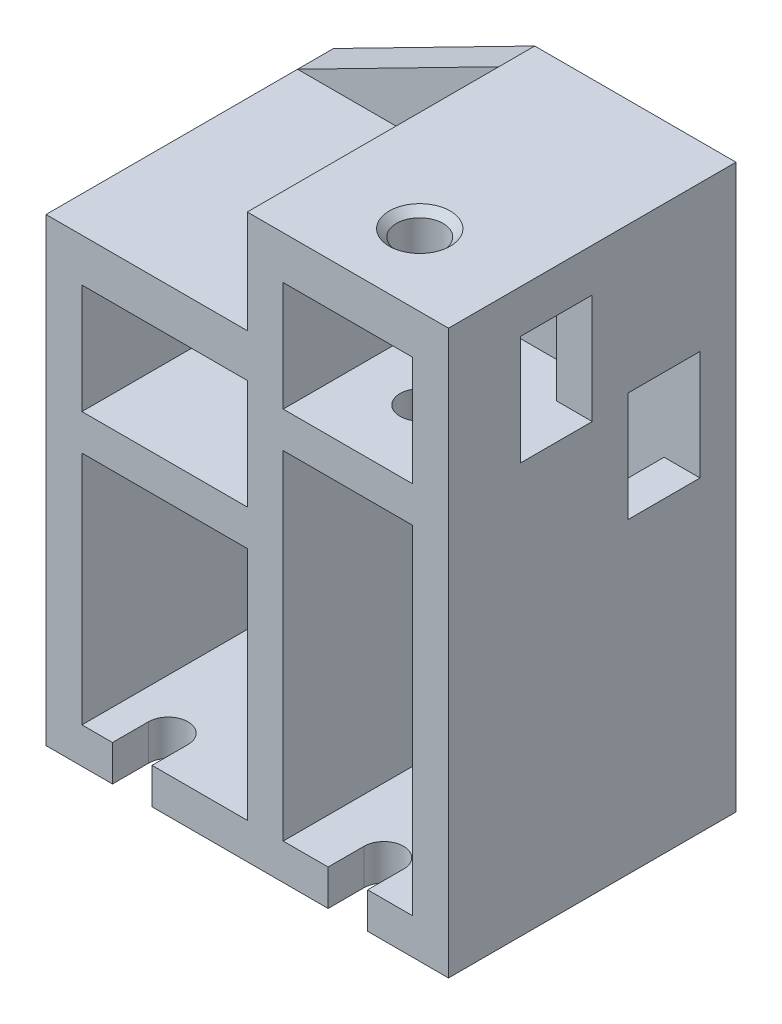
from build123d import *

# Parameters (mm, degrees)
SKETCH1_W           = 23
SKETCH1_H           = 32.75
SKETCH1_W_2         = 18
SKETCH1_H_2         = 15.25
SKETCH1_H_3         = 47.05
BOSS_EXTRUDE1_DEPTH = 40
CUT_EXTRUDE1_REACH  = 106.244
SKETCH2_R           = 2.75
CUT_EXTRUDE2_REACH  = 106.244
SKETCH3_W           = 10
SKETCH3_H           = 15.25
SKETCH4_W           = 10
SKETCH4_H           = 15.25
CUT_EXTRUDE3_DEPTH  = 102.645904984
CUT_EXTRUDE4_REACH  = 106.244
SKETCH6_R           = 3.25
CHAMFER1_SIZE       = 1
CUT_EXTRUDE5_REACH  = 106.244
SKETCH7_R           = 3.3
SKETCH9_R           = 2.75
CUT_EXTRUDE6_DEPTH  = 101.542975886
SKETCH10_W          = 18
SKETCH10_H          = 25
SKETCH10_W_2        = 23
SKETCH10_H_2        = 10.7
BOSS_EXTRUDE2_DEPTH = 5


with BuildPart() as part:
    # Sketch1 → Boss-Extrude1 (new body)
    with BuildSketch(Plane.XY):
        Polygon((0, 0), (0, 64), (28, 64), (28, 78.3), (56, 78.3), (56, 0), align=None)
        with Locations((16.5, 21.375)):
            Rectangle(SKETCH1_W, SKETCH1_H, mode=Mode.SUBTRACT)
        with Locations((42, 64.675)):
            Rectangle(SKETCH1_W_2, SKETCH1_H_2, mode=Mode.SUBTRACT)
        with Locations((16.5, 50.375)):
            Rectangle(SKETCH1_W, SKETCH1_H_2, mode=Mode.SUBTRACT)
        with Locations((42, 28.525)):
            Rectangle(SKETCH1_W_2, SKETCH1_H_3, mode=Mode.SUBTRACT)
    extrude(amount=BOSS_EXTRUDE1_DEPTH)

    # Cut-Extrude1: up to this face of the body (flat: up to its plane)
    cut_extrude1_end = Plane(part.part.faces().sort_by_distance((16.5, 37.75, 20))[0])
    # Sketch2 → Cut-Extrude1 (cut, up to the picked face)
    with BuildSketch(Plane(origin=(0, 78.3, 0), x_dir=(1, 0, 0), z_dir=(0, 1, 0)), mode=Mode.PRIVATE) as cut_extrude1_sk1:
        with Locations(Location((19, -15, 0), (0, 0, 270))):
            Circle(SKETCH2_R)
    cut_extrude1_tool1 = split(extrude(cut_extrude1_sk1.sketch, amount=-CUT_EXTRUDE1_REACH, mode=Mode.PRIVATE), bisect_by=cut_extrude1_end, keep=Keep.BOTH, mode=Mode.PRIVATE)
    # Sketch2 → Cut-Extrude1 (cut, up to the picked face)
    with BuildSketch(Plane(origin=(0, 78.3, 0), x_dir=(1, 0, 0), z_dir=(0, 1, 0)), mode=Mode.PRIVATE) as cut_extrude1_sk2:
        with Locations(Location((42, -30, 0), (0, 0, 270))):
            Circle(SKETCH2_R)
    cut_extrude1_tool2 = split(extrude(cut_extrude1_sk2.sketch, amount=-CUT_EXTRUDE1_REACH, mode=Mode.PRIVATE), bisect_by=cut_extrude1_end, keep=Keep.BOTH, mode=Mode.PRIVATE)
    add(cut_extrude1_tool1.solids().sort_by(Axis((19, 78.3, 15), (0, -1, 0)))[0], mode=Mode.SUBTRACT)
    add(cut_extrude1_tool2.solids().sort_by(Axis((42, 78.3, 30), (0, -1, 0)))[0], mode=Mode.SUBTRACT)

    # Sketch3 → Cut-Extrude2 (cut, up to next)
    with BuildSketch(Plane(origin=(56, 0, 0), x_dir=(0, 0, -1), z_dir=(1, 0, 0)), mode=Mode.PRIVATE) as cut_extrude2_sk1:
        with Locations((-25, 64.675)):
            Rectangle(SKETCH3_W, SKETCH3_H)
    cut_extrude2_tool1 = extrude(cut_extrude2_sk1.sketch, amount=-CUT_EXTRUDE2_REACH, mode=Mode.PRIVATE) & part.part
    add(cut_extrude2_tool1.solids().sort_by_distance((56, 64.675, 25))[0], mode=Mode.SUBTRACT)

    # Sketch4 → Cut-Extrude3 (cut, through all)
    with BuildSketch(Plane(origin=(5, 0, 0), x_dir=(0, 0, -1), z_dir=(1, 0, 0))):
        with Locations((-10, 50.375)):
            Rectangle(SKETCH4_W, SKETCH4_H)
    extrude(amount=CUT_EXTRUDE3_DEPTH, mode=Mode.SUBTRACT)

    # Sketch6 → Cut-Extrude4 (cut, up to next)
    with BuildSketch(Plane(origin=(0, 78.3, 0), x_dir=(1, 0, 0), z_dir=(0, 1, 0)), mode=Mode.PRIVATE) as cut_extrude4_sk1:
        with Locations(Location((19, -15, 0), (0, 0, 270))):
            Circle(SKETCH6_R)
    cut_extrude4_tool1 = extrude(cut_extrude4_sk1.sketch, amount=-CUT_EXTRUDE4_REACH, mode=Mode.PRIVATE) & part.part
    # Sketch6 → Cut-Extrude4 (cut, up to next)
    with BuildSketch(Plane(origin=(0, 78.3, 0), x_dir=(1, 0, 0), z_dir=(0, 1, 0)), mode=Mode.PRIVATE) as cut_extrude4_sk2:
        with Locations(Location((42, -30, 0), (0, 0, 270))):
            Circle(SKETCH6_R)
    cut_extrude4_tool2 = extrude(cut_extrude4_sk2.sketch, amount=-CUT_EXTRUDE4_REACH, mode=Mode.PRIVATE) & part.part
    add(cut_extrude4_tool1.solids().sort_by_distance((19, 78.3, 15))[0], mode=Mode.SUBTRACT)
    add(cut_extrude4_tool2.solids().sort_by_distance((42, 78.3, 30))[0], mode=Mode.SUBTRACT)

    # Chamfer1
    chamfer1_edges = [part.edges().sort_by_distance(p)[0] for p in [
        (19, 64, 11.75),
        (42, 78.3, 26.75),
    ]]
    chamfer(chamfer1_edges, length=CHAMFER1_SIZE)

    # Sketch7 → Cut-Extrude5 (cut, up to next)
    with BuildSketch(Plane.XZ, mode=Mode.PRIVATE) as cut_extrude5_sk1:
        with Locations((12, 15)):
            Circle(SKETCH7_R)
    cut_extrude5_tool1 = extrude(cut_extrude5_sk1.sketch, amount=-CUT_EXTRUDE5_REACH, mode=Mode.PRIVATE) & part.part
    # Sketch7 → Cut-Extrude5 (cut, up to next)
    with BuildSketch(Plane.XZ, mode=Mode.PRIVATE) as cut_extrude5_sk2:
        with Locations((42, 15)):
            Circle(SKETCH7_R)
    cut_extrude5_tool2 = extrude(cut_extrude5_sk2.sketch, amount=-CUT_EXTRUDE5_REACH, mode=Mode.PRIVATE) & part.part
    # Sketch7 → Cut-Extrude5 (cut, up to next)
    with BuildSketch(Plane.XZ, mode=Mode.PRIVATE) as cut_extrude5_sk3:
        with BuildLine():
            Line((9.25, 35), (9.25, 40))
            Line((9.25, 40), (14.75, 40))
            Line((14.75, 40), (14.75, 35))
            ThreePointArc((14.75, 35), (12, 32.25), (9.25, 35))
        make_face()
    cut_extrude5_tool3 = extrude(cut_extrude5_sk3.sketch, amount=-CUT_EXTRUDE5_REACH, mode=Mode.PRIVATE) & part.part
    # Sketch7 → Cut-Extrude5 (cut, up to next)
    with BuildSketch(Plane.XZ, mode=Mode.PRIVATE) as cut_extrude5_sk4:
        with BuildLine():
            Line((39.25, 35), (39.25, 40))
            Line((39.25, 40), (44.75, 40))
            Line((44.75, 40), (44.75, 35))
            ThreePointArc((44.75, 35), (42, 32.25), (39.25, 35))
        make_face()
    cut_extrude5_tool4 = extrude(cut_extrude5_sk4.sketch, amount=-CUT_EXTRUDE5_REACH, mode=Mode.PRIVATE) & part.part
    add(cut_extrude5_tool1.solids().sort_by_distance((12, 0, 15))[0], mode=Mode.SUBTRACT)
    add(cut_extrude5_tool2.solids().sort_by_distance((42, 0, 15))[0], mode=Mode.SUBTRACT)
    add(cut_extrude5_tool3.solids().sort_by_distance((12, 0, 36.393769))[0], mode=Mode.SUBTRACT)
    add(cut_extrude5_tool4.solids().sort_by_distance((42, 0, 36.393769))[0], mode=Mode.SUBTRACT)

    # Sketch9 → Cut-Extrude6 (cut, through all)
    with BuildSketch(Plane(origin=(0, 5, 0), x_dir=(1, 0, 0), z_dir=(0, 1, 0))):
        with Locations(Location((19, -15, 0), (0, 0, 270))):
            Circle(SKETCH9_R)
    extrude(amount=-CUT_EXTRUDE6_DEPTH, mode=Mode.SUBTRACT)

    # Sketch10 → Boss-Extrude2 (add)
    with BuildSketch(Plane(origin=(0, 0, 0), x_dir=(-1, 0, 0), z_dir=(0, 0, -1))):
        Polygon((-28, 78.3), (0, 64), (-28, 64), align=None)
        with Locations((-42, 39.55)):
            Rectangle(SKETCH10_W, SKETCH10_H)
        with Locations((-16.5, 32.4)):
            Rectangle(SKETCH10_W_2, SKETCH10_H_2)
    extrude(amount=-BOSS_EXTRUDE2_DEPTH)


solid = part.part
